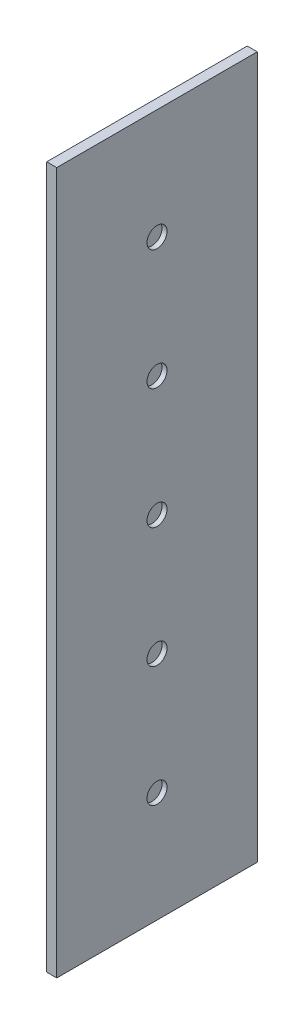
from build123d import *

# Parameters (mm, degrees)
CROQUIS1_W              = 10
CROQUIS1_H              = 700
SALIENTE_EXTRUIR1_DEPTH = 200
CROQUIS2_R              = 10
CORTAR_EXTRUIR1_DEPTH   = 5


with BuildPart() as part:
    # Croquis1 → Saliente-Extruir1 (new body)
    with BuildSketch(Plane.XY):
        with Locations((5, 350)):
            Rectangle(CROQUIS1_W, CROQUIS1_H)
    extrude(amount=SALIENTE_EXTRUIR1_DEPTH)

    # Croquis2 → Cortar-Extruir1 (cut)
    with BuildSketch(Plane(origin=(10, 0, 0), x_dir=(0, 0, -1), z_dir=(1, 0, 0))):
        with Locations((-100, 110)):
            Circle(CROQUIS2_R)
        with Locations((-100, 230)):
            Circle(CROQUIS2_R)
        with Locations((-100, 350)):
            Circle(CROQUIS2_R)
        with Locations((-100, 470)):
            Circle(CROQUIS2_R)
        with Locations((-100, 590)):
            Circle(CROQUIS2_R)
    extrude(amount=-CORTAR_EXTRUIR1_DEPTH, mode=Mode.SUBTRACT)


solid = part.part
